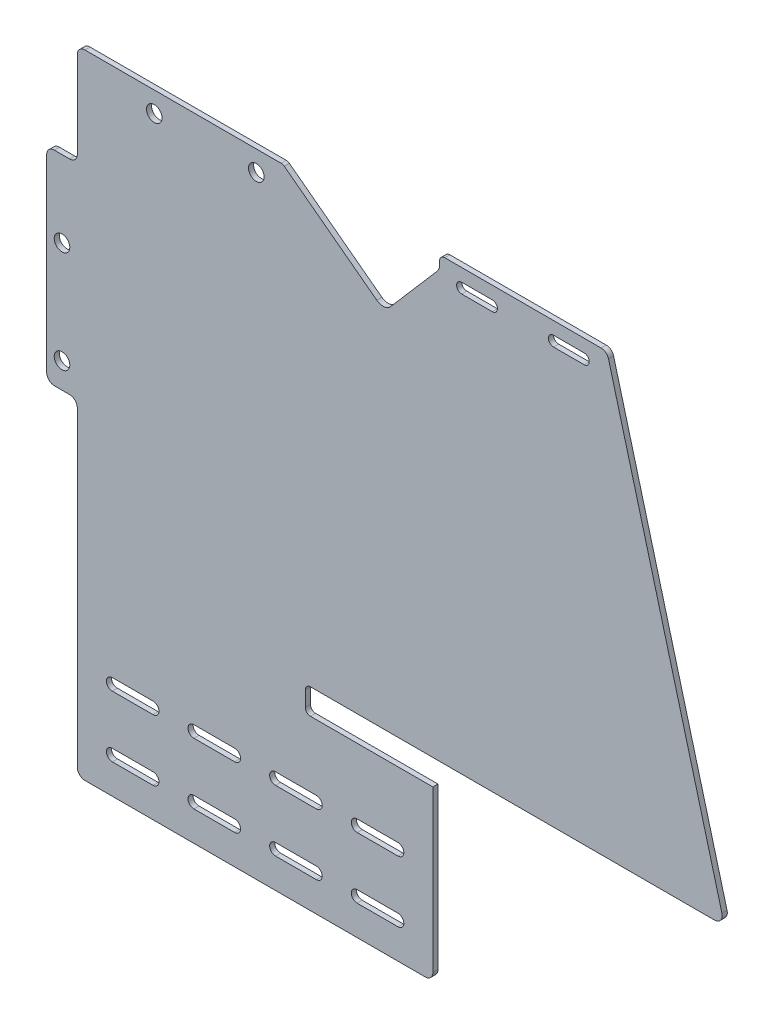
from build123d import *

# Parameters (mm, degrees)
SKETCH_1_W          = 140
SKETCH_1_H          = 124
EXTRUDE_1_DEPTH     = 0.5
CUT_EXTRUDE_1_DEPTH = 1.5
SKETCH_3_W          = 12
SKETCH_3_H          = 40
EXTRUDE_2_DEPTH     = 1
SKETCH_5_R          = 1.525
CUT_EXTRUDE_3_DEPTH = 10
FILLET_1_R          = 1.5
SKETCH_8_W          = 26.5
SKETCH_8_H          = 5
CUT_EXTRUDE_5_DEPTH = 10
CUT_EXTRUDE_6_DEPTH = 10
CUT_EXTRUDE_7_DEPTH = 10
FILLET_2_R          = 2
FILLET_3_R          = 1
FILLET_4_R          = 1
CUT_EXTRUDE_8_DEPTH = 5


with BuildPart() as part:
    # 草图1 → 凸台-拉伸1 (new, symmetric)
    with BuildSketch(Plane.XY):
        Rectangle(SKETCH_1_W, SKETCH_1_H)
    extrude(amount=EXTRUDE_1_DEPTH, both=True)

    # 草图2 → 切除-拉伸1 (cut, symmetric)
    with BuildSketch(Plane.XY.offset(0.5)):
        Polygon((-0.3, -62), (-0.3, -24), (56.860254038, -24), (33.816623489, 62), (70, 62), (70, -62), align=None)
    extrude(amount=CUT_EXTRUDE_1_DEPTH, both=True, mode=Mode.SUBTRACT)

    # 草图3 → 凸台-拉伸2 (add)
    with BuildSketch(Plane.XY.offset(0.5)):
        with Locations((-70, 22)):
            Rectangle(SKETCH_3_W, SKETCH_3_H)
    extrude(amount=-EXTRUDE_2_DEPTH)

    # 草图5 → 切除-拉伸3 (cut)
    with BuildSketch(Plane(origin=(0, 0, -0.5), x_dir=(-1, 0, 0), z_dir=(0, 0, -1))):
        with Locations((34.915427319, 58)):
            Circle(SKETCH_5_R)
        with Locations((54.915427319, 58)):
            Circle(SKETCH_5_R)
        with Locations((73, 27)):
            Circle(SKETCH_5_R)
        with Locations((73, 7)):
            Circle(SKETCH_5_R)
    extrude(amount=-CUT_EXTRUDE_3_DEPTH, mode=Mode.SUBTRACT)

    # 圆角1
    fillet_1_edges = [part.edges().sort_by_distance(p)[0] for p in [
        (-0.3, -62, 0),
        (-0.3, -24, 0),
        (56.860254038, -24, 0),
        (33.816623489, 62, 0),
        (-76, 42, 0),
        (-70, 42, 0),
        (-76, 2, 0),
        (-70, 2, 0),
        (-70, -62, 0),
        (-70, 62, 0),
    ]]
    fillet(fillet_1_edges, radius=FILLET_1_R)

    # 草图8 → 切除-拉伸5 (cut)
    with BuildSketch(Plane(origin=(0, 0, -0.5), x_dir=(-1, 0, 0), z_dir=(0, 0, -1))):
        with Locations((12.05, -26.5)):
            Rectangle(SKETCH_8_W, SKETCH_8_H)
    extrude(amount=-CUT_EXTRUDE_5_DEPTH, mode=Mode.SUBTRACT)

    # 草图9 → 切除-拉伸6 (cut)
    with BuildSketch(Plane(origin=(0, 0, -0.5), x_dir=(-1, 0, 0), z_dir=(0, 0, -1))):
        with BuildLine():
            Line((23.15, -41.85), (31.15, -41.85))
            ThreePointArc((31.15, -41.85), (32.3, -43), (31.15, -44.15))
            Line((31.15, -44.15), (23.15, -44.15))
            ThreePointArc((23.15, -44.15), (22, -43), (23.15, -41.85))
        make_face()
        with BuildLine():
            Line((7.15, -41.85), (15.15, -41.85))
            ThreePointArc((15.15, -41.85), (16.3, -43), (15.15, -44.15))
            Line((15.15, -44.15), (7.15, -44.15))
            ThreePointArc((7.15, -44.15), (6, -43), (7.15, -41.85))
        make_face()
        with BuildLine():
            Line((47.15, -41.85), (39.15, -41.85))
            ThreePointArc((39.15, -41.85), (38, -43), (39.15, -44.15))
            Line((39.15, -44.15), (47.15, -44.15))
            ThreePointArc((47.15, -44.15), (48.3, -43), (47.15, -41.85))
        make_face()
        with BuildLine():
            Line((63.15, -41.85), (55.15, -41.85))
            ThreePointArc((55.15, -41.85), (54, -43), (55.15, -44.15))
            Line((55.15, -44.15), (63.15, -44.15))
            ThreePointArc((63.15, -44.15), (64.3, -43), (63.15, -41.85))
        make_face()
        with BuildLine():
            Line((23.15, -56.15), (31.15, -56.15))
            ThreePointArc((31.15, -56.15), (32.3, -55), (31.15, -53.85))
            Line((31.15, -53.85), (23.15, -53.85))
            ThreePointArc((23.15, -53.85), (22, -55), (23.15, -56.15))
        make_face()
        with BuildLine():
            Line((7.15, -56.15), (15.15, -56.15))
            ThreePointArc((15.15, -56.15), (16.3, -55), (15.15, -53.85))
            Line((15.15, -53.85), (7.15, -53.85))
            ThreePointArc((7.15, -53.85), (6, -55), (7.15, -56.15))
        make_face()
        with BuildLine():
            Line((47.15, -56.15), (39.15, -56.15))
            ThreePointArc((39.15, -56.15), (38, -55), (39.15, -53.85))
            Line((39.15, -53.85), (47.15, -53.85))
            ThreePointArc((47.15, -53.85), (48.3, -55), (47.15, -56.15))
        make_face()
        with BuildLine():
            Line((63.15, -56.15), (55.15, -56.15))
            ThreePointArc((55.15, -56.15), (54, -55), (55.15, -53.85))
            Line((55.15, -53.85), (63.15, -53.85))
            ThreePointArc((63.15, -53.85), (64.3, -55), (63.15, -56.15))
        make_face()
    extrude(amount=-CUT_EXTRUDE_6_DEPTH, mode=Mode.SUBTRACT)

    # 草图10 → 切除-拉伸7 (cut)
    with BuildSketch(Plane.XY.offset(0.5)):
        Polygon((1.02106128, 59.531168527), (1.02106128, 62), (-29.703905389, 62), (-9.798233064, 47), align=None)
    extrude(amount=-CUT_EXTRUDE_7_DEPTH, mode=Mode.SUBTRACT)

    # 圆角2
    fillet_2_edges = [part.edges().sort_by_distance(p)[0] for p in [
        (1.02106128, 59.531168527, 0),
        (-9.798233064, 47, 0),
    ]]
    fillet(fillet_2_edges, radius=FILLET_2_R)

    # 圆角3
    fillet_3_edges = [part.edges().sort_by_distance(p)[0] for p in [
        (-29.703905389, 62, 0),
        (1.02106128, 62, 0),
    ]]
    fillet(fillet_3_edges, radius=FILLET_3_R)

    # 圆角4
    fillet_4_edges = [part.edges().sort_by_distance(p)[0] for p in [
        (-25.3, -24, 0),
        (-25.3, -29, 0),
    ]]
    fillet(fillet_4_edges, radius=FILLET_4_R)

    # 草图11 → 切除-拉伸8 (cut, symmetric)
    with BuildSketch(Plane(origin=(0, 0, -0.5), x_dir=(-1, 0, 0), z_dir=(0, 0, -1))):
        with BuildLine():
            Line((-29.343347144, 59.5), (-23.343347144, 59.5))
            ThreePointArc((-23.343347144, 59.5), (-22.343347144, 58.5), (-23.343347144, 57.5))
            Line((-23.343347144, 57.5), (-29.343347144, 57.5))
            ThreePointArc((-29.343347144, 57.5), (-30.343347144, 58.5), (-29.343347144, 59.5))
        make_face()
        with BuildLine():
            Line((-5.343347144, 59.5), (-11.343347144, 59.5))
            ThreePointArc((-11.343347144, 59.5), (-12.343347144, 58.5), (-11.343347144, 57.5))
            Line((-11.343347144, 57.5), (-5.343347144, 57.5))
            ThreePointArc((-5.343347144, 57.5), (-4.343347144, 58.5), (-5.343347144, 59.5))
        make_face()
    extrude(amount=CUT_EXTRUDE_8_DEPTH, both=True, mode=Mode.SUBTRACT)


solid = part.part
